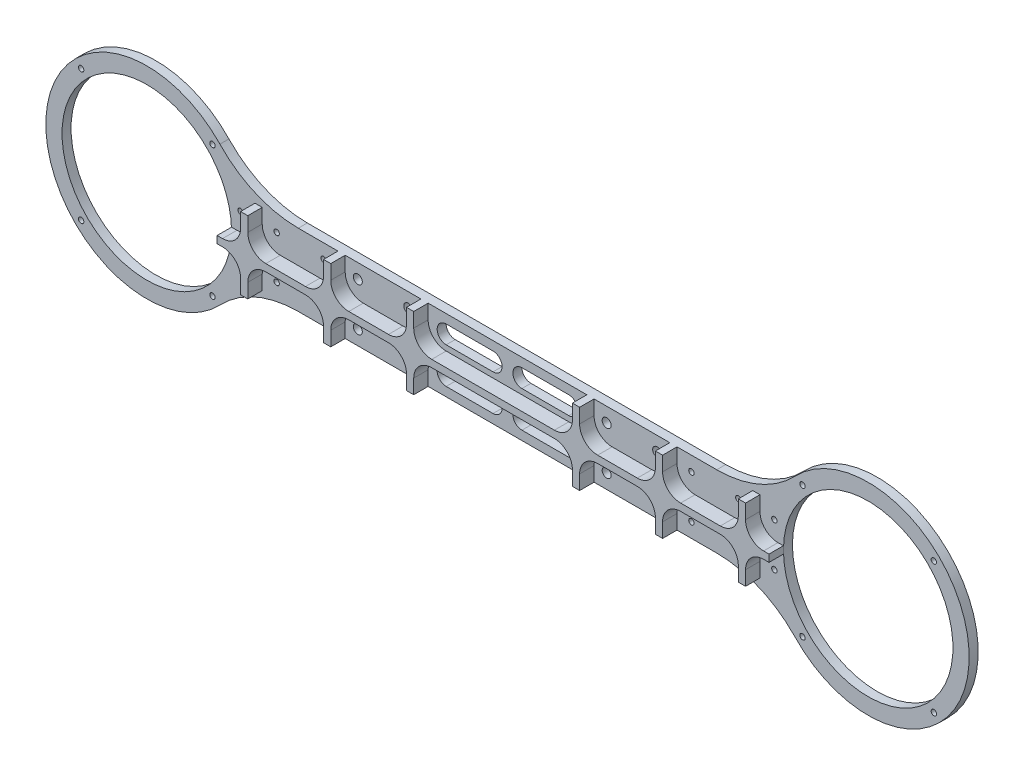
from build123d import *

# Parameters (mm, degrees)
SKETCH_1_R           = 47
EXTRUDE_1_DEPTH      = 5
FILLET_1_R           = 60
SKETCH_31_R          = 1.5
CUT_EXTRUDE_14_DEPTH = 5
SKETCH_32_W          = 306
SKETCH_32_H          = 4
EXTRUDE_2_DEPTH      = 8
CUT_EXTRUDE_17_DEPTH = 8
SKETCH_35_R          = 2.5
CUT_EXTRUDE_18_DEPTH = 10
EXTRUDE_3_DEPTH      = 5
SKETCH_37_R          = 1.5
CUT_EXTRUDE_19_DEPTH = 10
SKETCH_38_W          = 4
SKETCH_38_H          = 40
EXTRUDE_4_DEPTH      = 8
FILLET_2_R           = 10
SKETCH_41_R          = 1.5
SKETCH_41_R_2        = 2.5
CUT_EXTRUDE_20_DEPTH = 10


with BuildPart() as part:
    # 草图1 → 凸台-拉伸1 (new body)
    with BuildSketch(Plane.XY):
        with BuildLine():
            Line((347.693212678, 20), (52.306787322, 20))
            ThreePointArc((52.306787322, 20), (-56, 0), (52.306787322, -20))
            Line((52.306787322, -20), (347.693212678, -20))
            ThreePointArc((347.693212678, -20), (456, 0), (347.693212678, 20))
        make_face()
        Circle(SKETCH_1_R, mode=Mode.SUBTRACT)
        with Locations((400, 0)):
            Circle(SKETCH_1_R, mode=Mode.SUBTRACT)
    extrude(amount=EXTRUDE_1_DEPTH)

    # 圆角1
    fillet_1_edges = [part.edges().sort_by_distance(p)[0] for p in [
        (347.693212678, -20, 2.5),
        (52.306787322, -20, 2.5),
        (52.306787322, 20, 2.5),
        (347.693212678, 20, 2.5),
    ]]
    fillet(fillet_1_edges, radius=FILLET_1_R)

    # 草图31 → 切除-拉伸14 (cut)
    with BuildSketch(Plane.XY.offset(5)):
        with Locations((36.415999231, 36.415999231)):
            Circle(SKETCH_31_R)
        with Locations((36.415999231, -36.415999231)):
            Circle(SKETCH_31_R)
        with Locations((-36.415999231, -36.415999231)):
            Circle(SKETCH_31_R)
        with Locations((-36.415999231, 36.415999231)):
            Circle(SKETCH_31_R)
        with Locations(Location((436.415999231, 36.415999231, 0), (0, 0, 180))):
            Circle(SKETCH_31_R)
        with Locations(Location((436.415999231, -36.415999231, 0), (0, 0, 180))):
            Circle(SKETCH_31_R)
        with Locations(Location((363.584000769, -36.415999231, 0), (0, 0, 180))):
            Circle(SKETCH_31_R)
        with Locations(Location((363.584000769, 36.415999231, 0), (0, 0, 180))):
            Circle(SKETCH_31_R)
    extrude(amount=-CUT_EXTRUDE_14_DEPTH, mode=Mode.SUBTRACT)

    # 草图32 → 凸台-拉伸2 (add)
    with BuildSketch(Plane.XY.offset(5)):
        with Locations((200, 0)):
            Rectangle(SKETCH_32_W, SKETCH_32_H)
    extrude(amount=EXTRUDE_2_DEPTH)

    # 草图34 → 切除-拉伸17 (cut)
    with BuildSketch(Plane.XY.offset(5)):
        with BuildLine():
            Line((164, 5), (192, 5))
            ThreePointArc((192, 5), (197, 10), (192, 15))
            Line((192, 15), (164, 15))
            ThreePointArc((164, 15), (159, 10), (164, 5))
        make_face()
        with BuildLine():
            Line((164, -15), (192, -15))
            ThreePointArc((192, -15), (197, -10), (192, -5))
            Line((192, -5), (164, -5))
            ThreePointArc((164, -5), (159, -10), (164, -15))
        make_face()
        with BuildLine():
            Line((208, 15), (236, 15))
            ThreePointArc((236, 15), (241, 10), (236, 5))
            Line((236, 5), (208, 5))
            ThreePointArc((208, 5), (203, 10), (208, 15))
        make_face()
        with BuildLine():
            Line((208, -5), (236, -5))
            ThreePointArc((236, -5), (241, -10), (236, -15))
            Line((236, -15), (208, -15))
            ThreePointArc((208, -15), (203, -10), (208, -5))
        make_face()
    extrude(amount=-CUT_EXTRUDE_17_DEPTH, mode=Mode.SUBTRACT)

    # 草图35 → 切除-拉伸18 (cut)
    with BuildSketch(Plane.XY.offset(5)):
        with Locations((145, 12)):
            Circle(SKETCH_35_R)
        with Locations((145, -12)):
            Circle(SKETCH_35_R)
        with Locations((255, 12)):
            Circle(SKETCH_35_R)
        with Locations((255, -12)):
            Circle(SKETCH_35_R)
    extrude(amount=-CUT_EXTRUDE_18_DEPTH, mode=Mode.SUBTRACT)

    # 草图36 → 凸台-拉伸3 (add)
    with BuildSketch(Plane.XY.offset(5)):
        with BuildLine():
            Line((164, 15), (166, 15))
            ThreePointArc((166, 15), (161, 10), (166, 5))
            Line((166, 5), (164, 5))
            ThreePointArc((164, 5), (159, 10), (164, 15))
        make_face()
        with BuildLine():
            Line((164, -5), (166, -5))
            ThreePointArc((166, -5), (161, -10), (166, -15))
            Line((166, -15), (164, -15))
            ThreePointArc((164, -15), (159, -10), (164, -5))
        make_face()
        with BuildLine():
            Line((234, 15), (236, 15))
            ThreePointArc((236, 15), (241, 10), (236, 5))
            Line((236, 5), (234, 5))
            ThreePointArc((234, 5), (239, 10), (234, 15))
        make_face()
        with BuildLine():
            Line((234, -5), (236, -5))
            ThreePointArc((236, -5), (241, -10), (236, -15))
            Line((236, -15), (234, -15))
            ThreePointArc((234, -15), (239, -10), (234, -5))
        make_face()
    extrude(amount=-EXTRUDE_3_DEPTH)

    # 草图37 → 切除-拉伸19 (cut)
    with BuildSketch(Plane.XY.offset(5)):
        with Locations((72.001998556, -12.000000249)):
            Circle(SKETCH_37_R)
        with Locations((72.001998556, 11.999999751)):
            Circle(SKETCH_37_R)
        with Locations((52.000000094, -12.000000249)):
            Circle(SKETCH_37_R)
        with Locations((52.000000094, 11.999999751)):
            Circle(SKETCH_37_R)
        with Locations((347.999999906, 11.999999751)):
            Circle(SKETCH_37_R)
        with Locations((347.999999906, -12.000000249)):
            Circle(SKETCH_37_R)
        with Locations((327.998001444, 11.999999751)):
            Circle(SKETCH_37_R)
        with Locations((327.998001444, -12.000000249)):
            Circle(SKETCH_37_R)
    extrude(amount=-CUT_EXTRUDE_19_DEPTH, mode=Mode.SUBTRACT)

    # 草图38 → 凸台-拉伸4 (add)
    with BuildSketch(Plane.XY.offset(5)):
        with Locations((62.000999325, 0)):
            Rectangle(SKETCH_38_W, SKETCH_38_H)
        with Locations((108.000999325, 0)):
            Rectangle(SKETCH_38_W, SKETCH_38_H)
        with Locations((154.000999325, 0)):
            Rectangle(SKETCH_38_W, SKETCH_38_H)
        with Locations((245.999000675, 0)):
            Rectangle(SKETCH_38_W, SKETCH_38_H)
        with Locations((291.999000675, 0)):
            Rectangle(SKETCH_38_W, SKETCH_38_H)
        with Locations((337.999000675, 0)):
            Rectangle(SKETCH_38_W, SKETCH_38_H)
    extrude(amount=EXTRUDE_4_DEPTH)

    # 圆角2
    fillet_2_edges = [part.edges().sort_by_distance(p)[0] for p in [
        (64.000999325, 2, 9),
        (64.000999325, -2, 9),
        (60.000999325, 2, 9),
        (60.000999325, -2, 9),
        (110.000999325, 2, 9),
        (110.000999325, -2, 9),
        (106.000999325, 2, 9),
        (106.000999325, -2, 9),
        (156.000999325, 2, 9),
        (156.000999325, -2, 9),
        (152.000999325, 2, 9),
        (152.000999325, -2, 9),
        (247.999000675, 2, 9),
        (247.999000675, -2, 9),
        (243.999000675, 2, 9),
        (243.999000675, -2, 9),
        (293.999000675, 2, 9),
        (293.999000675, -2, 9),
        (289.999000675, 2, 9),
        (289.999000675, -2, 9),
        (339.999000675, 2, 9),
        (339.999000675, -2, 9),
        (335.999000675, 2, 9),
        (335.999000675, -2, 9),
    ]]
    fillet(fillet_2_edges, radius=FILLET_2_R)

    # 草图41 → 切除-拉伸20 (cut)
    with BuildSketch(Plane.XY.offset(5)):
        with Locations((327.998001444, -12.000000249)):
            Circle(SKETCH_41_R)
        with Locations((327.998001444, 11.999999751)):
            Circle(SKETCH_41_R)
        with Locations((255, -12)):
            Circle(SKETCH_41_R_2)
        with Locations((255, 12)):
            Circle(SKETCH_41_R_2)
        with Locations((145, -12)):
            Circle(SKETCH_41_R_2)
        with Locations((145, 12)):
            Circle(SKETCH_41_R_2)
        with Locations((72.001998556, -12.000000249)):
            Circle(SKETCH_41_R)
        with Locations((72.001998556, 11.999999751)):
            Circle(SKETCH_41_R)
        with Locations((98.000000094, -12.000000249)):
            Circle(SKETCH_41_R)
        with Locations((98.000000094, 11.999999751)):
            Circle(SKETCH_41_R)
        with Locations((117.001998651, -12)):
            Circle(SKETCH_41_R_2)
        with Locations((117.001998651, 12)):
            Circle(SKETCH_41_R_2)
        with Locations((282.998001349, -12)):
            Circle(SKETCH_41_R_2)
        with Locations((282.998001349, 12)):
            Circle(SKETCH_41_R_2)
        with Locations((301.999999906, -12.000000249)):
            Circle(SKETCH_41_R)
        with Locations((301.999999906, 11.999999751)):
            Circle(SKETCH_41_R)
    extrude(amount=-CUT_EXTRUDE_20_DEPTH, mode=Mode.SUBTRACT)


solid = part.part
